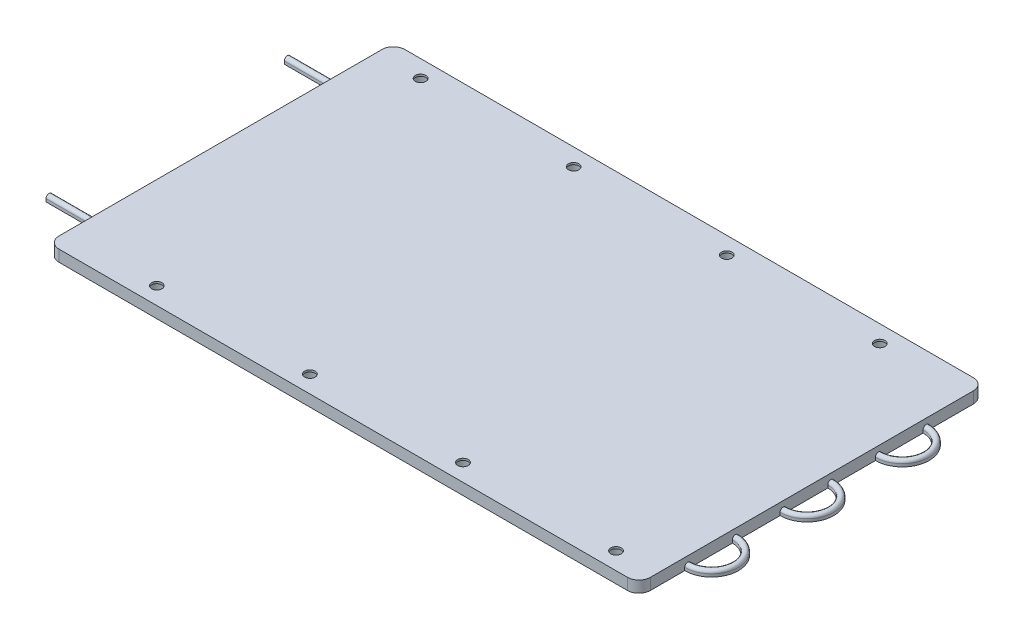
from build123d import *

# Parameters (mm, degrees)
SKETCH1_W                      = 310
SKETCH1_H                      = 181.3
BOSS_EXTRUDE1_DEPTH            = 6
FILLET1_R                      = 6
CBORE_FOR_M5_SHCS1_D           = 5.5
CBORE_FOR_M5_SHCS1_DEPTH       = 6
CBORE_FOR_M5_SHCS1_CBORE_D     = 10
CBORE_FOR_M5_SHCS1_CBORE_DEPTH = 5
CBORE_FOR_M5_SHCS1_TIP         = 1.652366702


with BuildPart() as part:
    # Sketch1 → Boss-Extrude1 (new body)
    with BuildSketch(Plane(origin=(0, 0, 0), x_dir=(1, 0, 0), z_dir=(0, 1, 0))):
        Rectangle(SKETCH1_W, SKETCH1_H)
    extrude(amount=BOSS_EXTRUDE1_DEPTH)

    # Fillet1
    fillet1_edges = [part.edges().sort_by_distance(p)[0] for p in [
        (155, 3, 90.65),
        (-155, 3, 90.65),
        (-155, 3, -90.65),
        (155, 3, -90.65),
    ]]
    fillet(fillet1_edges, radius=FILLET1_R)

    # CBORE for M5 SHCS1
    with Locations(Plane.XZ):
        with Locations((-131.75, -81.65), (-106.75, 81.65), (-26.5, 81.65), (134, 81.65), (-51.5, -81.65), (28.75, -81.65), (109, -81.65), (53.75, 81.65)):
            CounterBoreHole(CBORE_FOR_M5_SHCS1_D / 2, CBORE_FOR_M5_SHCS1_CBORE_D / 2, CBORE_FOR_M5_SHCS1_CBORE_DEPTH, depth=CBORE_FOR_M5_SHCS1_DEPTH)
            with Locations((0, 0, -(CBORE_FOR_M5_SHCS1_DEPTH + CBORE_FOR_M5_SHCS1_TIP / 2))):  # 118° drill point
                Cone(0, CBORE_FOR_M5_SHCS1_D / 2, CBORE_FOR_M5_SHCS1_TIP, mode=Mode.SUBTRACT)

    # Cut-Sweep2: sweep along a path in Sketch15
    with BuildLine(Plane(origin=(0, 0, 0), x_dir=(-1, 0, 0), z_dir=(0, -1, 0))) as cut_sweep2_path:
        Line((179.853246079, -65.054213185), (155, -65.054213185))
        Line((155, -65.054213185), (-155, -65.054213185))
        ThreePointArc((-155, -65.054213185), (-167.5, -52.554213185), (-155, -40.054213185))
        Line((-155, -40.054213185), (133.207142099, -40.054213185))
        ThreePointArc((133.207142099, -40.054213185), (145.707142099, -27.554213185), (133.207142099, -15.054213185))
        Line((133.207142099, -15.054213185), (-155, -15.054213185))
        ThreePointArc((-155, -15.054213185), (-167.5, -2.554213185), (-155, 9.945786815))
        Line((-155, 9.945786815), (133.207142099, 9.945786815))
        ThreePointArc((133.207142099, 9.945786815), (145.707142099, 22.445786815), (133.207142099, 34.945786815))
        Line((133.207142099, 34.945786815), (-155, 34.945786815))
        ThreePointArc((-155, 34.945786815), (-167.5, 47.445786815), (-155, 59.945786815))
        Line((-155, 59.945786815), (155.063400619, 59.945786815))
        Line((155.063400619, 59.945786815), (179.916646698, 59.945786815))
    # Sketch16 → Cut-Sweep2 (sweep, cut)
    with BuildSketch(Plane.ZY.offset(155)):
        with BuildLine():
            Line((66.641713185, 1.5), (66.641713185, 0))
            Line((66.641713185, 0), (63.466713185, 0))
            Line((63.466713185, 0), (63.466713185, 1.5))
            ThreePointArc((63.466713185, 1.5), (65.054213185, 3.0875), (66.641713185, 1.5))
        make_face()
    sweep(path=cut_sweep2_path.line, mode=Mode.SUBTRACT)


with BuildPart() as body_2:
    # Sweep1: sweep along a path in Sketch15<2>
    with BuildLine(Plane(origin=(0, 0, 0), x_dir=(-1, 0, 0), z_dir=(0, -1, 0))) as sweep1_path:
        Line((179.853246079, -65.054213185), (155, -65.054213185))
        Line((155, -65.054213185), (-155, -65.054213185))
        ThreePointArc((-155, -65.054213185), (-167.5, -52.554213185), (-155, -40.054213185))
        Line((-155, -40.054213185), (133.207142099, -40.054213185))
        ThreePointArc((133.207142099, -40.054213185), (145.707142099, -27.554213185), (133.207142099, -15.054213185))
        Line((133.207142099, -15.054213185), (-155, -15.054213185))
        ThreePointArc((-155, -15.054213185), (-167.5, -2.554213185), (-155, 9.945786815))
        Line((-155, 9.945786815), (133.207142099, 9.945786815))
        ThreePointArc((133.207142099, 9.945786815), (145.707142099, 22.445786815), (133.207142099, 34.945786815))
        Line((133.207142099, 34.945786815), (-155, 34.945786815))
        ThreePointArc((-155, 34.945786815), (-167.5, 47.445786815), (-155, 59.945786815))
        Line((-155, 59.945786815), (155.063400619, 59.945786815))
        Line((155.063400619, 59.945786815), (179.916646698, 59.945786815))
    # Sketch17 → Sweep1 (sweep)
    with BuildSketch(Plane.ZY.offset(155)):
        with BuildLine():
            Line((-61.533286815, 1.5), (-61.533286815, 0))
            Line((-61.533286815, 0), (-58.358286815, 0))
            Line((-58.358286815, 0), (-58.358286815, 1.5))
            ThreePointArc((-58.358286815, 1.5), (-59.945786815, 3.0875), (-61.533286815, 1.5))
        make_face()
        with BuildLine():
            Line((-60.771286815, 1.5), (-60.771286815, 0.762))
            Line((-60.771286815, 0.762), (-59.120286815, 0.762))
            Line((-59.120286815, 0.762), (-59.120286815, 1.5))
            ThreePointArc((-59.120286815, 1.5), (-59.945786815, 2.3255), (-60.771286815, 1.5))
        make_face(mode=Mode.SUBTRACT)
    sweep(path=sweep1_path.line)


solid = Compound([part.part, body_2.part])
